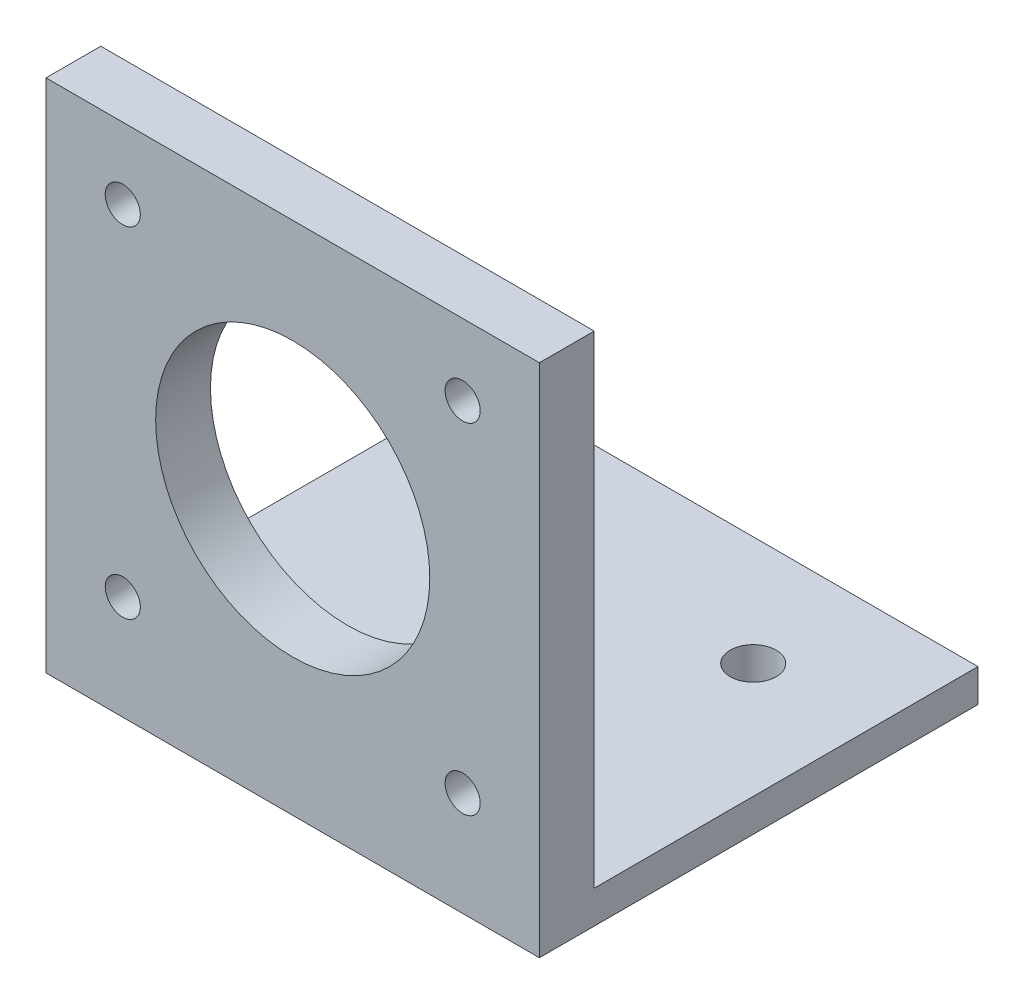
from build123d import *

# Parameters (mm, degrees)
SKETCH_2_W          = 45
SKETCH_2_H          = 40
EXTRUDE_1_DEPTH     = 3
SKETCH_3_R          = 2.1
CUT_EXTRUDE_1_DEPTH = 31.253099015
SKETCH_4_W          = 45
SKETCH_4_H          = 5
EXTRUDE_2_DEPTH     = 44
SKETCH_6_R          = 1.6
SKETCH_6_R_2        = 12.5
CUT_EXTRUDE_3_DEPTH = 63.77141069


with BuildPart() as part:
    # ｽｹｯﾁ2 → ﾎﾞｽ - 押し出し1 (new body)
    with BuildSketch(Plane(origin=(0, 0, 0), x_dir=(1, 0, 0), z_dir=(0, 1, 0))):
        Rectangle(SKETCH_2_W, SKETCH_2_H)
    extrude(amount=EXTRUDE_1_DEPTH)

    # ｽｹｯﾁ3 → ｶｯﾄ - 押し出し1 (cut, through all)
    with BuildSketch(Plane(origin=(0, 3, 0), x_dir=(1, 0, 0), z_dir=(0, 1, 0))):
        with Locations(Location((-12, 10, 0), (0, 0, 270))):
            Circle(SKETCH_3_R)
        with Locations(Location((12, 10, 0), (0, 0, 90))):
            Circle(SKETCH_3_R)
        with Locations(Location((12, -10, 0), (0, 0, 270))):
            Circle(SKETCH_3_R)
        with Locations(Location((-12, -10, 0), (0, 0, 90))):
            Circle(SKETCH_3_R)
    extrude(amount=-CUT_EXTRUDE_1_DEPTH, mode=Mode.SUBTRACT)

    # ｽｹｯﾁ4 → ﾎﾞｽ - 押し出し2 (add)
    with BuildSketch(Plane(origin=(0, 3, 0), x_dir=(1, 0, 0), z_dir=(0, 1, 0))):
        with Locations((0, -17.5)):
            Rectangle(SKETCH_4_W, SKETCH_4_H)
    extrude(amount=EXTRUDE_2_DEPTH)

    # ｽｹｯﾁ6 → ｶｯﾄ - 押し出し3 (cut, through all)
    with BuildSketch(Plane(origin=(0, 0, 15), x_dir=(-1, 0, 0), z_dir=(0, 0, -1))):
        with Locations((-15.5, 40.5)):
            Circle(SKETCH_6_R)
        with Locations(Location((15.5, 40.5, 0), (0, 0, 180))):
            Circle(SKETCH_6_R)
        with Locations((15.5, 9.5)):
            Circle(SKETCH_6_R)
        with Locations(Location((-15.5, 9.5, 0), (0, 0, 180))):
            Circle(SKETCH_6_R)
        with Locations((0, 25)):
            Circle(SKETCH_6_R_2)
    extrude(amount=-CUT_EXTRUDE_3_DEPTH, mode=Mode.SUBTRACT)


solid = part.part
